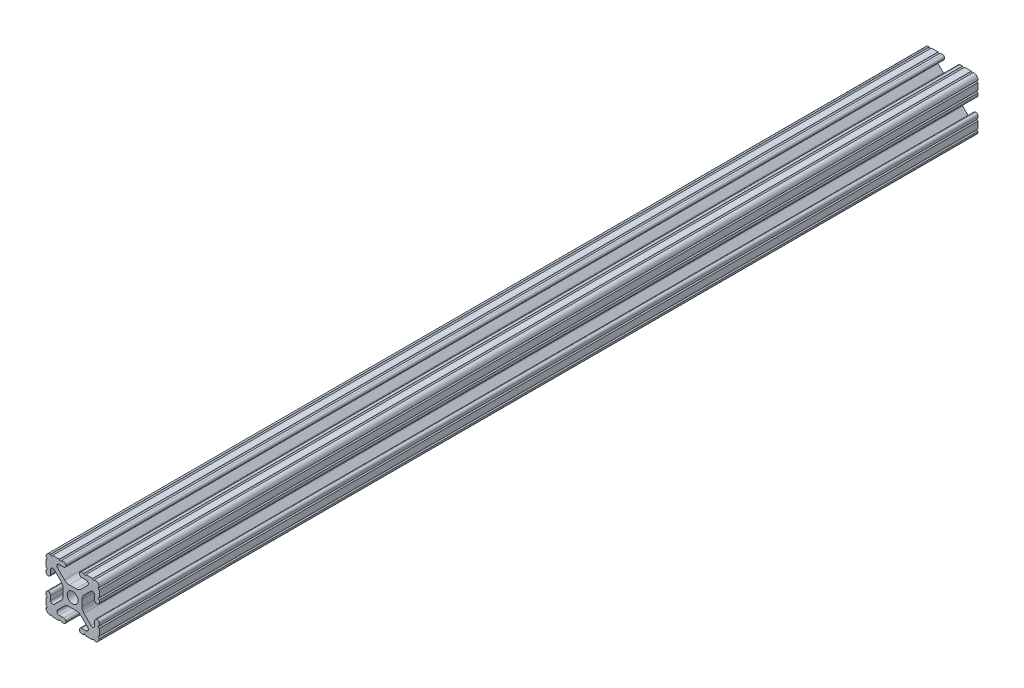
from build123d import *

# Parameters (mm, degrees)
SKETCH1_R      = 2.6035
EXTRUDE1_DEPTH = 419.1


with BuildPart() as part:
    # Sketch1 → Extrude1 (new body)
    with BuildSketch(Plane.XY):
        with BuildLine():
            Line((-7.207036008, 8.724370562), (-3.898272566, 5.423169045))
            ThreePointArc((-3.898272566, 5.423169045), (-2.869120213, 4.736787962), (-1.655778399, 4.4958))
            Line((-1.655778399, 4.4958), (1.655778399, 4.4958))
            ThreePointArc((1.655778399, 4.4958), (2.869120213, 4.736787962), (3.898272566, 5.423169045))
            Line((3.898272566, 5.423169045), (7.207036008, 8.724370562))
            ThreePointArc((7.207036008, 8.724370562), (7.432222385, 9.85140422), (6.476788598, 10.4902))
            Line((6.476788598, 10.4902), (4.287512407, 10.4902))
            ThreePointArc((4.287512407, 10.4902), (3.54574862, 10.79744862), (3.2385, 11.539212407))
            Line((3.2385, 11.539212407), (3.2385, 11.650987593))
            ThreePointArc((3.2385, 11.650987593), (3.54574862, 12.39275138), (4.287512407, 12.7))
            Line((4.287512407, 12.7), (5.317126718, 12.7))
            ThreePointArc((5.317126718, 12.7), (5.825126718, 12.192), (6.333126718, 12.7))
            Line((6.333126718, 12.7), (9.550443118, 12.7))
            ThreePointArc((9.550443118, 12.7), (10.058366869, 12.192000006), (10.566443095, 12.699847501))
            ThreePointArc((10.566443095, 12.699847501), (12.082537762, 12.08250727), (12.699846982, 10.566399977))
            ThreePointArc((12.699846982, 10.566399977), (12.192000006, 10.058323491), (12.7, 9.5504))
            Line((12.7, 9.5504), (12.7, 6.3330836))
            ThreePointArc((12.7, 6.3330836), (12.192, 5.8250836), (12.7, 5.3170836))
            Line((12.7, 5.3170836), (12.7, 4.287469289))
            ThreePointArc((12.7, 4.287469289), (12.39275138, 3.545705502), (11.650987593, 3.238456882))
            Line((11.650987593, 3.238456882), (11.539212407, 3.238456882))
            ThreePointArc((11.539212407, 3.238456882), (10.79744862, 3.545705502), (10.4902, 4.287469289))
            Line((10.4902, 4.287469289), (10.4902, 6.402089023))
            ThreePointArc((10.4902, 6.402089023), (9.856505071, 7.351067942), (8.737131347, 7.129408934))
            Line((8.737131347, 7.129408934), (5.441005833, 3.840816462))
            ThreePointArc((5.441005833, 3.840816462), (4.750877967, 2.809883091), (4.5085, 1.593185507))
            Line((4.5085, 1.593185507), (4.5085, -1.593185507))
            ThreePointArc((4.5085, -1.593185507), (4.750877967, -2.809883091), (5.441005833, -3.840816462))
            Line((5.441005833, -3.840816462), (8.737131347, -7.129408934))
            ThreePointArc((8.737131347, -7.129408934), (9.856505071, -7.351067942), (10.4902, -6.402089023))
            Line((10.4902, -6.402089023), (10.4902, -4.287469289))
            ThreePointArc((10.4902, -4.287469289), (10.79744862, -3.545705502), (11.539212407, -3.238456882))
            Line((11.539212407, -3.238456882), (11.650987593, -3.238456882))
            ThreePointArc((11.650987593, -3.238456882), (12.39275138, -3.545705502), (12.7, -4.287469289))
            Line((12.7, -4.287469289), (12.7, -5.3170836))
            ThreePointArc((12.7, -5.3170836), (12.192, -5.8250836), (12.7, -6.3330836))
            Line((12.7, -6.3330836), (12.7, -9.5504))
            ThreePointArc((12.7, -9.5504), (12.192000006, -10.058323491), (12.699846982, -10.566399977))
            ThreePointArc((12.699846982, -10.566399977), (12.082537762, -12.08250727), (10.566443095, -12.699847501))
            ThreePointArc((10.566443095, -12.699847501), (10.058366869, -12.192000006), (9.550443118, -12.7))
            Line((9.550443118, -12.7), (6.333126718, -12.7))
            ThreePointArc((6.333126718, -12.7), (5.825126718, -12.192), (5.317126718, -12.7))
            Line((5.317126718, -12.7), (4.287512407, -12.7))
            ThreePointArc((4.287512407, -12.7), (3.54574862, -12.39275138), (3.2385, -11.650987593))
            Line((3.2385, -11.650987593), (3.2385, -11.539212407))
            ThreePointArc((3.2385, -11.539212407), (3.54574862, -10.79744862), (4.287512407, -10.4902))
            Line((4.287512407, -10.4902), (6.416408329, -10.4902))
            ThreePointArc((6.416408329, -10.4902), (7.41473083, -9.822813117), (7.179650497, -8.645192506))
            Line((7.179650497, -8.645192506), (3.952270251, -5.423690499))
            ThreePointArc((3.952270251, -5.423690499), (2.922936451, -4.736929036), (1.709253557, -4.4958))
            Line((1.709253557, -4.4958), (-1.709253557, -4.4958))
            ThreePointArc((-1.709253557, -4.4958), (-2.922936451, -4.736929036), (-3.952270251, -5.423690499))
            Line((-3.952270251, -5.423690499), (-7.179650497, -8.645192506))
            ThreePointArc((-7.179650497, -8.645192506), (-7.41473083, -9.822813117), (-6.416408329, -10.4902))
            Line((-6.416408329, -10.4902), (-4.287512407, -10.4902))
            ThreePointArc((-4.287512407, -10.4902), (-3.54574862, -10.79744862), (-3.2385, -11.539212407))
            Line((-3.2385, -11.539212407), (-3.2385, -11.650987593))
            ThreePointArc((-3.2385, -11.650987593), (-3.54574862, -12.39275138), (-4.287512407, -12.7))
            Line((-4.287512407, -12.7), (-5.317126718, -12.7))
            ThreePointArc((-5.317126718, -12.7), (-5.825126718, -12.192), (-6.333126718, -12.7))
            Line((-6.333126718, -12.7), (-9.550443118, -12.7))
            ThreePointArc((-9.550443118, -12.7), (-10.058366869, -12.192000006), (-10.566443095, -12.699847501))
            ThreePointArc((-10.566443095, -12.699847501), (-12.082537762, -12.08250727), (-12.699846982, -10.566399977))
            ThreePointArc((-12.699846982, -10.566399977), (-12.192000006, -10.058323491), (-12.7, -9.5504))
            Line((-12.7, -9.5504), (-12.7, -6.3330836))
            ThreePointArc((-12.7, -6.3330836), (-12.192, -5.8250836), (-12.7, -5.3170836))
            Line((-12.7, -5.3170836), (-12.7, -4.287469289))
            ThreePointArc((-12.7, -4.287469289), (-12.39275138, -3.545705502), (-11.650987593, -3.238456882))
            Line((-11.650987593, -3.238456882), (-11.539212407, -3.238456882))
            ThreePointArc((-11.539212407, -3.238456882), (-10.79744862, -3.545705502), (-10.4902, -4.287469289))
            Line((-10.4902, -4.287469289), (-10.4902, -6.402089023))
            ThreePointArc((-10.4902, -6.402089023), (-9.856505071, -7.351067942), (-8.737131347, -7.129408934))
            Line((-8.737131347, -7.129408934), (-5.441005833, -3.840816462))
            ThreePointArc((-5.441005833, -3.840816462), (-4.750877967, -2.809883091), (-4.5085, -1.593185507))
            Line((-4.5085, -1.593185507), (-4.5085, 1.593185507))
            ThreePointArc((-4.5085, 1.593185507), (-4.750877967, 2.809883091), (-5.441005833, 3.840816462))
            Line((-5.441005833, 3.840816462), (-8.737131347, 7.129408934))
            ThreePointArc((-8.737131347, 7.129408934), (-9.856505071, 7.351067942), (-10.4902, 6.402089023))
            Line((-10.4902, 6.402089023), (-10.4902, 4.287469289))
            ThreePointArc((-10.4902, 4.287469289), (-10.79744862, 3.545705502), (-11.539212407, 3.238456882))
            Line((-11.539212407, 3.238456882), (-11.650987593, 3.238456882))
            ThreePointArc((-11.650987593, 3.238456882), (-12.39275138, 3.545705502), (-12.7, 4.287469289))
            Line((-12.7, 4.287469289), (-12.7, 5.3170836))
            ThreePointArc((-12.7, 5.3170836), (-12.192, 5.8250836), (-12.7, 6.3330836))
            Line((-12.7, 6.3330836), (-12.7, 9.5504))
            ThreePointArc((-12.7, 9.5504), (-12.192000006, 10.058323491), (-12.699846982, 10.566399977))
            ThreePointArc((-12.699846982, 10.566399977), (-12.082537762, 12.08250727), (-10.566443095, 12.699847501))
            ThreePointArc((-10.566443095, 12.699847501), (-10.058366869, 12.192000006), (-9.550443118, 12.7))
            Line((-9.550443118, 12.7), (-6.333126718, 12.7))
            ThreePointArc((-6.333126718, 12.7), (-5.825126718, 12.192), (-5.317126718, 12.7))
            Line((-5.317126718, 12.7), (-4.287512407, 12.7))
            ThreePointArc((-4.287512407, 12.7), (-3.54574862, 12.39275138), (-3.2385, 11.650987593))
            Line((-3.2385, 11.650987593), (-3.2385, 11.539212407))
            ThreePointArc((-3.2385, 11.539212407), (-3.54574862, 10.79744862), (-4.287512407, 10.4902))
            Line((-4.287512407, 10.4902), (-6.476788598, 10.4902))
            ThreePointArc((-6.476788598, 10.4902), (-7.432222385, 9.85140422), (-7.207036008, 8.724370562))
        make_face()
        Circle(SKETCH1_R, mode=Mode.SUBTRACT)
    extrude(amount=-EXTRUDE1_DEPTH)


solid = part.part
